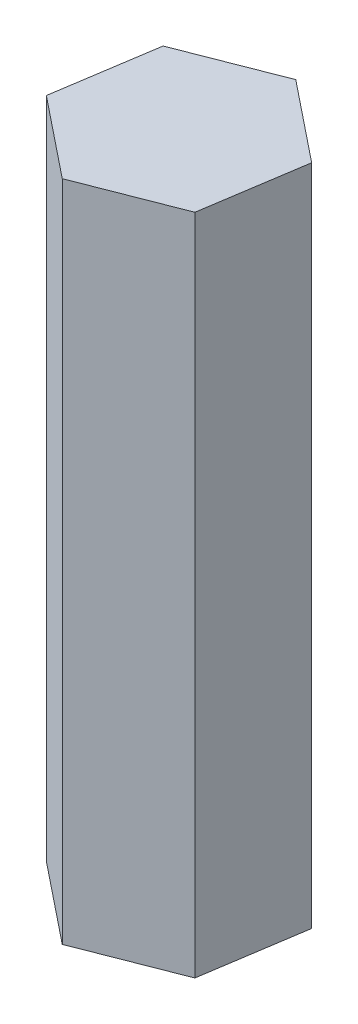
from build123d import *

# Parameters (mm, degrees)
BOSS_EXTRUDE1_DEPTH = 100


with BuildPart() as part:
    # Sketch1 → Boss-Extrude1 (new body)
    with BuildSketch(Plane(origin=(0, 0, 0), x_dir=(1, 0, 0), z_dir=(0, 1, 0))):
        Polygon((2.335779881, 15.269725195), (-12.056079987, 9.657707313), (-14.391859869, -5.612017883), (-2.335779881, -15.269725195), (12.056079987, -9.657707313), (14.391859869, 5.612017883), align=None)
    extrude(amount=BOSS_EXTRUDE1_DEPTH)


solid = part.part
